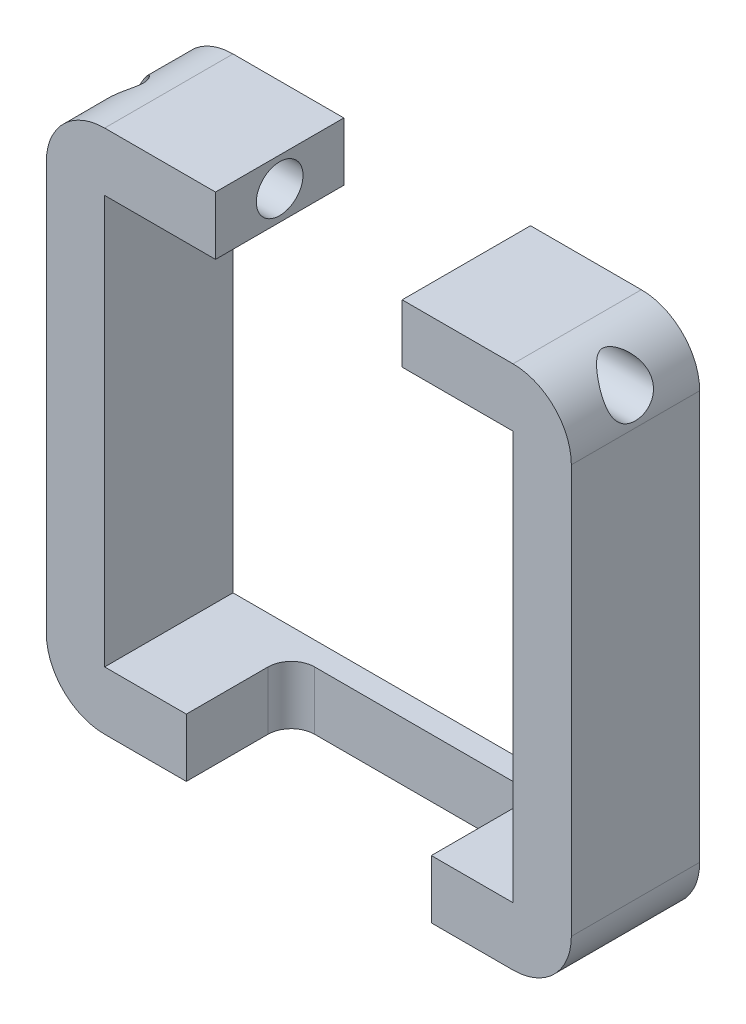
from build123d import *

# Parameters (mm, degrees)
ESQUISSE1_W                  = 35
ESQUISSE1_H                  = 35
BOSS_EXTRU_1_DEPTH           = 11
ESQUISSE2_W                  = 16
ESQUISSE2_H                  = 10
ENL_V_MAT_EXTRU_1_DEPTH      = 34.667491739
ESQUISSE3_R                  = 2
ENL_V_MAT_EXTRU_2_DEPTH      = 50
ENL_V_MAT_EXTRU_3_DEPTH      = 52.500000152
ENL_V_MAT_EXTRU_3_DEPTH_BACK = 40


with BuildPart() as part:
    # Esquisse1 → Boss.-Extru.1 (new body)
    with BuildSketch(Plane.XY):
        with BuildLine():
            Line((17.5, -22.5), (-17.5, -22.5))
            ThreePointArc((-17.5, -22.5), (-21.035533906, -21.035533906), (-22.5, -17.5))
            Line((-22.5, -17.5), (-22.5, 17.5))
            ThreePointArc((-22.5, 17.5), (-21.035533906, 21.035533906), (-17.5, 22.5))
            Line((-17.5, 22.5), (17.5, 22.5))
            ThreePointArc((17.5, 22.5), (21.035533906, 21.035533906), (22.5, 17.5))
            Line((22.5, 17.5), (22.5, -17.5))
            ThreePointArc((22.5, -17.5), (21.035533906, -21.035533906), (17.5, -22.5))
        make_face()
        Rectangle(ESQUISSE1_W, ESQUISSE1_H, mode=Mode.SUBTRACT)
    extrude(amount=BOSS_EXTRU_1_DEPTH)

    # Esquisse2 → Enlèv. mat.-Extru.1 (cut, through all)
    with BuildSketch(Plane.XY.offset(11)):
        with Locations((0, 20.5)):
            Rectangle(ESQUISSE2_W, ESQUISSE2_H)
    extrude(amount=-ENL_V_MAT_EXTRU_1_DEPTH, mode=Mode.SUBTRACT)

    # Esquisse3 → Enlèv. mat.-Extru.2 (cut, symmetric)
    with BuildSketch(Plane(origin=(-8, 0, 0), x_dir=(0, 0, -1), z_dir=(1, 0, 0))):
        with Locations(Location((-5.5, 20, 0), (0, 0, 90))):
            Circle(ESQUISSE3_R)
    extrude(amount=ENL_V_MAT_EXTRU_2_DEPTH, both=True, mode=Mode.SUBTRACT)

    # Esquisse4 → Enlèv. mat.-Extru.3 (cut, two sides: drawn at the far end of the back side and taken through both)
    with BuildSketch(Plane.XZ.offset(22.5).offset(-ENL_V_MAT_EXTRU_3_DEPTH_BACK)):
        with BuildLine():
            Line((10.5, 11), (0, 11))
            Line((0, 11), (0, 2))
            Line((0, 2), (8.5, 2))
            ThreePointArc((8.5, 2), (9.914213562, 2.585786438), (10.5, 4))
            Line((10.5, 4), (10.5, 11))
        make_face()
        with BuildLine():
            Line((0, 11), (-10.5, 11))
            Line((-10.5, 11), (-10.5, 4))
            ThreePointArc((-10.5, 4), (-9.914213562, 2.585786438), (-8.5, 2))
            Line((-8.5, 2), (0, 2))
            Line((0, 2), (0, 11))
        make_face()
    extrude(amount=ENL_V_MAT_EXTRU_3_DEPTH + ENL_V_MAT_EXTRU_3_DEPTH_BACK, mode=Mode.SUBTRACT)


solid = part.part
